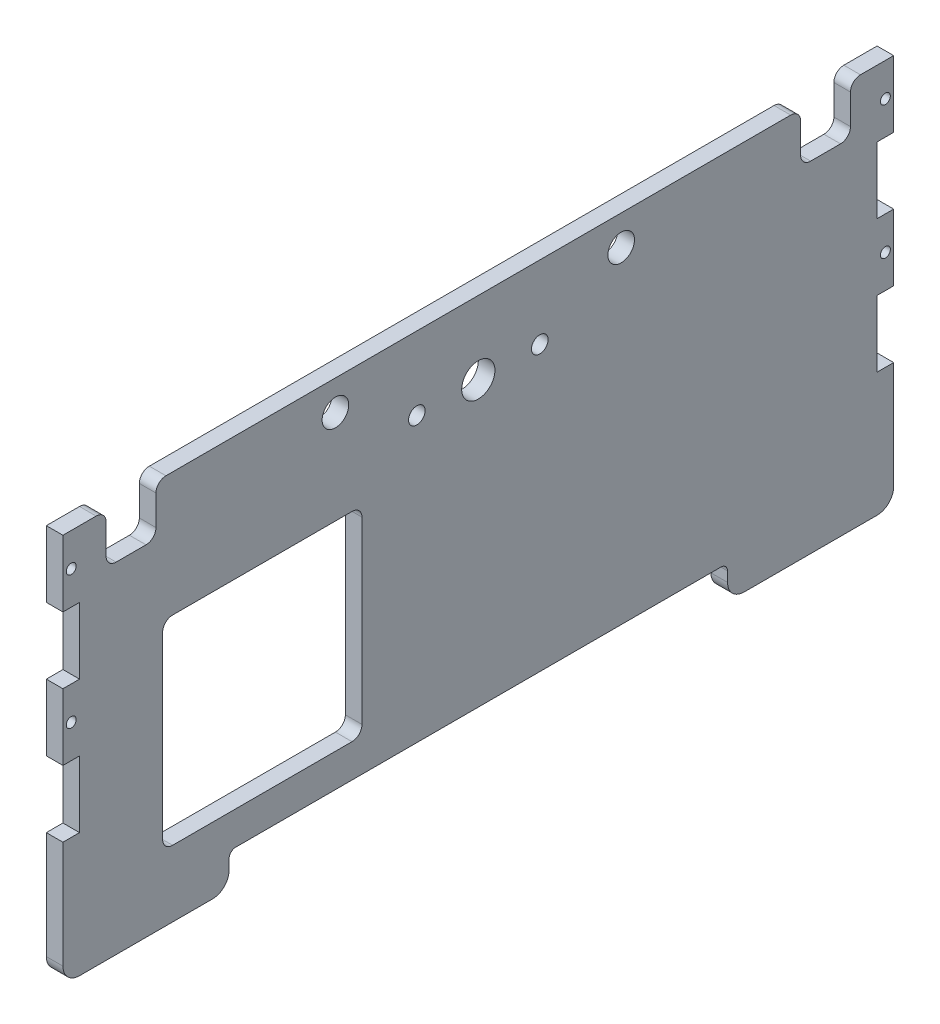
from build123d import *

# Parameters (mm, degrees)
SKETCH_1_R      = 4
SKETCH_1_R_2    = 5
SKETCH_1_R_3    = 2.5
SKETCH_1_R_4    = 1.5
EXTRUDE_1_DEPTH = 5


with BuildPart() as part:
    # 草图1 → 凸台-拉伸1 (new body)
    with BuildSketch(Plane(origin=(0, 0, 0), x_dir=(0, 0, -1), z_dir=(1, 0, 0))):
        with BuildLine():
            Line((-84.345470911, -47.190619808), (-84.345470911, -44.190619808))
            ThreePointArc((-84.345470911, -44.190619808), (-83.759684473, -42.776406245), (-82.345470911, -42.190619808))
            Line((-82.345470911, -42.190619808), (63.654529089, -42.190619808))
            ThreePointArc((63.654529089, -42.190619808), (65.068742652, -42.776406245), (65.654529089, -44.190619808))
            Line((65.654529089, -44.190619808), (65.654529089, -47.190619808))
            ThreePointArc((65.654529089, -47.190619808), (67.118995184, -50.726153713), (70.654529089, -52.190619808))
            Line((70.654529089, -52.190619808), (110.654529089, -52.190619808))
            ThreePointArc((110.654529089, -52.190619808), (114.190062995, -50.726153713), (115.654529089, -47.190619808))
            Line((115.654529089, -47.190619808), (115.654529089, -14.890619808))
            Line((115.654529089, -14.890619808), (110.654529089, -14.890619808))
            Line((110.654529089, -14.890619808), (110.654529089, 5.109380192))
            Line((110.654529089, 5.109380192), (115.654529089, 5.109380192))
            Line((115.654529089, 5.109380192), (115.654529089, 25.109380192))
            Line((115.654529089, 25.109380192), (110.654529089, 25.109380192))
            Line((110.654529089, 25.109380192), (110.654529089, 45.109380192))
            Line((110.654529089, 45.109380192), (115.654529089, 45.109380192))
            Line((115.654529089, 45.109380192), (115.654529089, 65.109380192))
            Line((115.654529089, 65.109380192), (105.654529089, 65.109380192))
            ThreePointArc((105.654529089, 65.109380192), (103.533208746, 64.230700536), (102.654529089, 62.109380192))
            Line((102.654529089, 62.109380192), (102.654529089, 53.109380192))
            ThreePointArc((102.654529089, 53.109380192), (101.775849433, 50.988059849), (99.654529089, 50.109380192))
            Line((99.654529089, 50.109380192), (90.654529089, 50.109380192))
            ThreePointArc((90.654529089, 50.109380192), (88.533208746, 50.988059849), (87.654529089, 53.109380192))
            Line((87.654529089, 53.109380192), (87.654529089, 62.109380192))
            ThreePointArc((87.654529089, 62.109380192), (86.775849433, 64.230700536), (84.654529089, 65.109380192))
            Line((84.654529089, 65.109380192), (-103.345470911, 65.109380192))
            ThreePointArc((-103.345470911, 65.109380192), (-105.466791254, 64.230700536), (-106.345470911, 62.109380192))
            Line((-106.345470911, 62.109380192), (-106.345470911, 53.109380192))
            ThreePointArc((-106.345470911, 53.109380192), (-107.224150567, 50.988059849), (-109.345470911, 50.109380192))
            Line((-109.345470911, 50.109380192), (-118.345470911, 50.109380192))
            ThreePointArc((-118.345470911, 50.109380192), (-120.466791254, 50.988059849), (-121.345470911, 53.109380192))
            Line((-121.345470911, 53.109380192), (-121.345470911, 62.109380192))
            ThreePointArc((-121.345470911, 62.109380192), (-122.224150567, 64.230700536), (-124.345470911, 65.109380192))
            Line((-124.345470911, 65.109380192), (-134.345470911, 65.109380192))
            Line((-134.345470911, 65.109380192), (-134.345470911, 45.109380192))
            Line((-134.345470911, 45.109380192), (-129.345470911, 45.109380192))
            Line((-129.345470911, 45.109380192), (-129.345470911, 25.109380192))
            Line((-129.345470911, 25.109380192), (-134.345470911, 25.109380192))
            Line((-134.345470911, 25.109380192), (-134.345470911, 5.109380192))
            Line((-134.345470911, 5.109380192), (-129.345470911, 5.109380192))
            Line((-129.345470911, 5.109380192), (-129.345470911, -14.890619808))
            Line((-129.345470911, -14.890619808), (-134.345470911, -14.890619808))
            Line((-134.345470911, -14.890619808), (-134.345470911, -47.190619808))
            ThreePointArc((-134.345470911, -47.190619808), (-132.881004816, -50.726153713), (-129.345470911, -52.190619808))
            Line((-129.345470911, -52.190619808), (-89.345470911, -52.190619808))
            ThreePointArc((-89.345470911, -52.190619808), (-85.809937005, -50.726153713), (-84.345470911, -47.190619808))
        make_face()
        with Locations((33.654529089, 56.109380192)):
            Circle(SKETCH_1_R, mode=Mode.SUBTRACT)
        with Locations((-52.345470911, 56.109380192)):
            Circle(SKETCH_1_R, mode=Mode.SUBTRACT)
        with Locations((-9.345470911, 43.109380192)):
            Circle(SKETCH_1_R_2, mode=Mode.SUBTRACT)
        with Locations((9.154529089, 43.109380192)):
            Circle(SKETCH_1_R_3, mode=Mode.SUBTRACT)
        with Locations((-27.845470911, 43.109380192)):
            Circle(SKETCH_1_R_3, mode=Mode.SUBTRACT)
        with Locations((113.154529089, 55.109380192)):
            Circle(SKETCH_1_R_4, mode=Mode.SUBTRACT)
        with Locations((-131.845470911, 55.109380192)):
            Circle(SKETCH_1_R_4, mode=Mode.SUBTRACT)
        with Locations((-131.845470911, 15.109380192)):
            Circle(SKETCH_1_R_4, mode=Mode.SUBTRACT)
        with Locations((113.154529089, 15.109380192)):
            Circle(SKETCH_1_R_4, mode=Mode.SUBTRACT)
        with BuildLine():
            Line((-101.345470911, -32.190619808), (-47.345470911, -32.190619808))
            ThreePointArc((-47.345470911, -32.190619808), (-45.224150567, -31.311940151), (-44.345470911, -29.190619808))
            Line((-44.345470911, -29.190619808), (-44.345470911, 24.809380192))
            ThreePointArc((-44.345470911, 24.809380192), (-45.224150567, 26.930700536), (-47.345470911, 27.809380192))
            Line((-47.345470911, 27.809380192), (-101.345470911, 27.809380192))
            ThreePointArc((-101.345470911, 27.809380192), (-103.466791254, 26.930700536), (-104.345470911, 24.809380192))
            Line((-104.345470911, 24.809380192), (-104.345470911, -29.190619808))
            ThreePointArc((-104.345470911, -29.190619808), (-103.466791254, -31.311940151), (-101.345470911, -32.190619808))
        make_face(mode=Mode.SUBTRACT)
    extrude(amount=EXTRUDE_1_DEPTH)


solid = part.part
